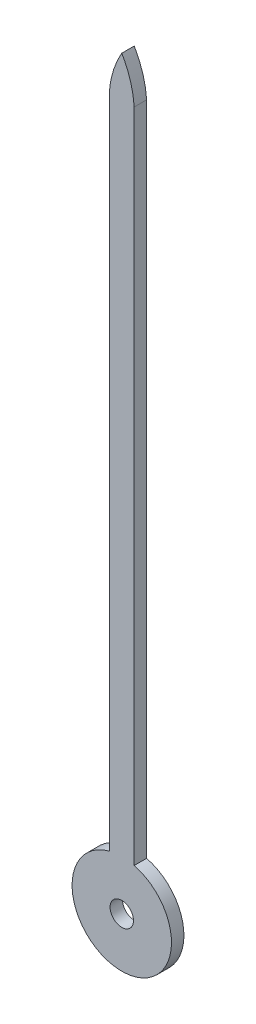
from build123d import *

# Parameters (mm, degrees)
SKETCH2_R           = 1.412460089
BOSS_EXTRUDE1_DEPTH = 1.5


with BuildPart() as part:
    # Sketch2 → Boss-Extrude1 (new body)
    with BuildSketch(Plane.XY):
        with BuildLine():
            Line((-1.5, 85.125143236), (-1.5, 5.809475019))
            ThreePointArc((-1.5, 5.809475019), (0, -6), (1.5, 5.809475019))
            Line((1.5, 5.809475019), (1.5, 85.125143236))
            add(Edge.make_bspline(
                [(0, 90), (1.319809251, 87.72856759), (1.5, 85.125143236)],
                knots=[0, 0, 0, 1, 1, 1], degree=2))
            add(Edge.make_bspline(
                [(0, 90), (-1.319809251, 87.72856759), (-1.5, 85.125143236)],
                knots=[0, 0, 0, 1, 1, 1], degree=2))
        make_face()
        Circle(SKETCH2_R, mode=Mode.SUBTRACT)
    extrude(amount=BOSS_EXTRUDE1_DEPTH)


solid = part.part
